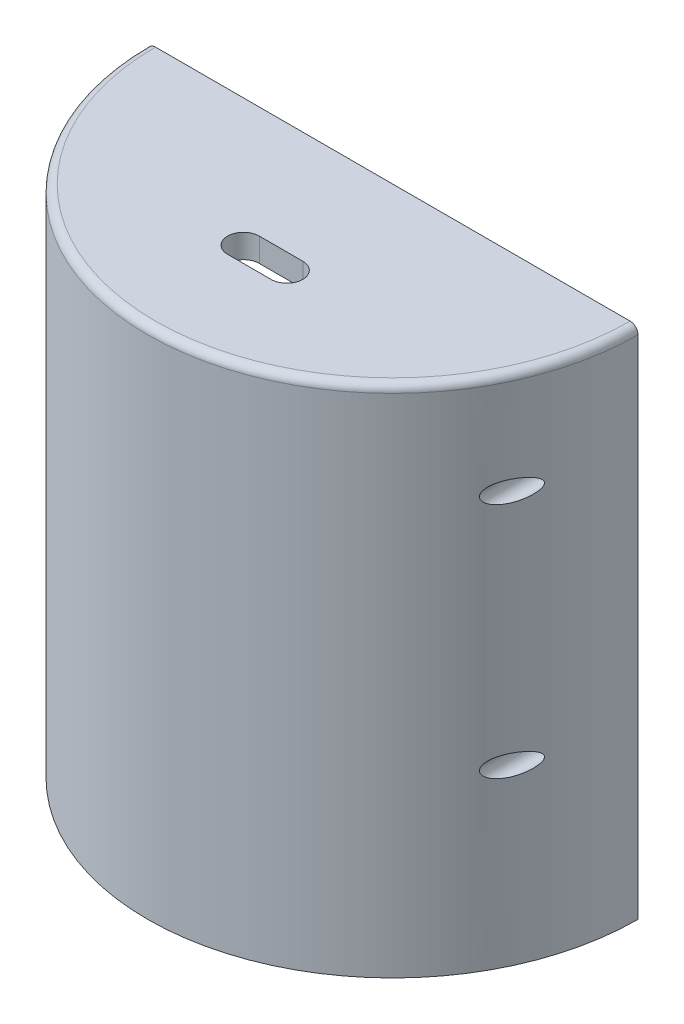
from build123d import *

# Parameters (mm, degrees)
EXTRUDE_1_DEPTH     = 65
EXTRUDE_5_REACH     = 80.403
SKETCH_12_R         = 3
SKETCH_16_R         = 1.3
CUT_EXTRUDE_2_DEPTH = 79.402806155
EXTRUDE_START       = -3
EXTRUDE_6_DEPTH     = 3
FILLET_1_R          = 1
CUT_EXTRUDE_3_REACH = 80.403


with BuildPart() as part:
    # Эскиз1 → Бобышка-Вытянуть1 (new body)
    with BuildSketch(Plane(origin=(0, 0, 0), x_dir=(1, 0, 0), z_dir=(0, 1, 0))):
        with BuildLine():
            Line((-31, 0), (-28, 0))
            ThreePointArc((-28, 0), (0, -28), (28, 0))
            Line((28, 0), (31, 0))
            ThreePointArc((31, 0), (0, -31), (-31, 0))
        make_face()
    extrude(amount=EXTRUDE_1_DEPTH)

    # Эскиз12 → Бобышка-Вытянуть5 (add, up to next)
    with BuildSketch(Plane(origin=(0, 0, 0), x_dir=(-1, 0, 0), z_dir=(0, 0, -1)), mode=Mode.PRIVATE) as extrude_5_sk1:
        with Locations((28, 52)):
            Circle(SKETCH_12_R)
    extrude_5_tool1 = extrude(extrude_5_sk1.sketch, amount=-EXTRUDE_5_REACH, mode=Mode.PRIVATE) - part.part
    # Эскиз12 → Бобышка-Вытянуть5 (add, up to next)
    with BuildSketch(Plane(origin=(0, 0, 0), x_dir=(-1, 0, 0), z_dir=(0, 0, -1)), mode=Mode.PRIVATE) as extrude_5_sk2:
        with Locations((28, 22)):
            Circle(SKETCH_12_R)
    extrude_5_tool2 = extrude(extrude_5_sk2.sketch, amount=-EXTRUDE_5_REACH, mode=Mode.PRIVATE) - part.part
    # Эскиз12 → Бобышка-Вытянуть5 (add, up to next)
    with BuildSketch(Plane(origin=(0, 0, 0), x_dir=(-1, 0, 0), z_dir=(0, 0, -1)), mode=Mode.PRIVATE) as extrude_5_sk3:
        with Locations((-28, 52)):
            Circle(SKETCH_12_R)
    extrude_5_tool3 = extrude(extrude_5_sk3.sketch, amount=-EXTRUDE_5_REACH, mode=Mode.PRIVATE) - part.part
    # Эскиз12 → Бобышка-Вытянуть5 (add, up to next)
    with BuildSketch(Plane(origin=(0, 0, 0), x_dir=(-1, 0, 0), z_dir=(0, 0, -1)), mode=Mode.PRIVATE) as extrude_5_sk4:
        with Locations((-28, 22)):
            Circle(SKETCH_12_R)
    extrude_5_tool4 = extrude(extrude_5_sk4.sketch, amount=-EXTRUDE_5_REACH, mode=Mode.PRIVATE) - part.part
    add(extrude_5_tool1.solids().sort_by_distance((-28, 52, 0))[0])
    add(extrude_5_tool2.solids().sort_by_distance((-28, 22, 0))[0])
    add(extrude_5_tool3.solids().sort_by_distance((28, 52, 0))[0])
    add(extrude_5_tool4.solids().sort_by_distance((28, 22, 0))[0])

    # Эскиз16 → Вырез-Вытянуть2 (cut, through all)
    with BuildSketch(Plane(origin=(0, 0, 0), x_dir=(-1, 0, 0), z_dir=(0, 0, -1))):
        with Locations((28, 52)):
            Circle(SKETCH_16_R)
        with Locations((28, 22)):
            Circle(SKETCH_16_R)
        with Locations((-28, 22)):
            Circle(SKETCH_16_R)
        with Locations((-28, 52)):
            Circle(SKETCH_16_R)
    extrude(amount=-CUT_EXTRUDE_2_DEPTH, mode=Mode.SUBTRACT)

    # Эскиз2 → Бобышка-Вытянуть6 (add)
    with BuildSketch(Plane(origin=(0, 65, 0), x_dir=(1, 0, 0), z_dir=(0, 1, 0)).offset(EXTRUDE_START)):
        with BuildLine():
            Line((-31, 0), (31, 0))
            ThreePointArc((31, 0), (0, -31), (-31, 0))
        make_face()
    extrude(amount=EXTRUDE_6_DEPTH)

    # Скругление1
    fillet_1_edges = [part.edges().sort_by_distance(p)[0] for p in [
        (0, 65, 31),
    ]]
    fillet(fillet_1_edges, radius=FILLET_1_R)

    # Эскиз18 → Вырез-Вытянуть3 (cut, up to next)
    with BuildSketch(Plane(origin=(0, 65, 0), x_dir=(1, 0, 0), z_dir=(0, 1, 0)), mode=Mode.PRIVATE) as cut_extrude_3_sk1:
        with BuildLine():
            Line((-2.75, -14.13), (2.75, -14.13))
            ThreePointArc((2.75, -14.13), (4.75, -16.13), (2.75, -18.13))
            Line((2.75, -18.13), (-2.75, -18.13))
            ThreePointArc((-2.75, -18.13), (-4.75, -16.13), (-2.75, -14.13))
        make_face()
    cut_extrude_3_tool1 = extrude(cut_extrude_3_sk1.sketch, amount=-CUT_EXTRUDE_3_REACH, mode=Mode.PRIVATE) & part.part
    add(cut_extrude_3_tool1.solids().sort_by_distance((0, 65, 16.13))[0], mode=Mode.SUBTRACT)


solid = part.part
